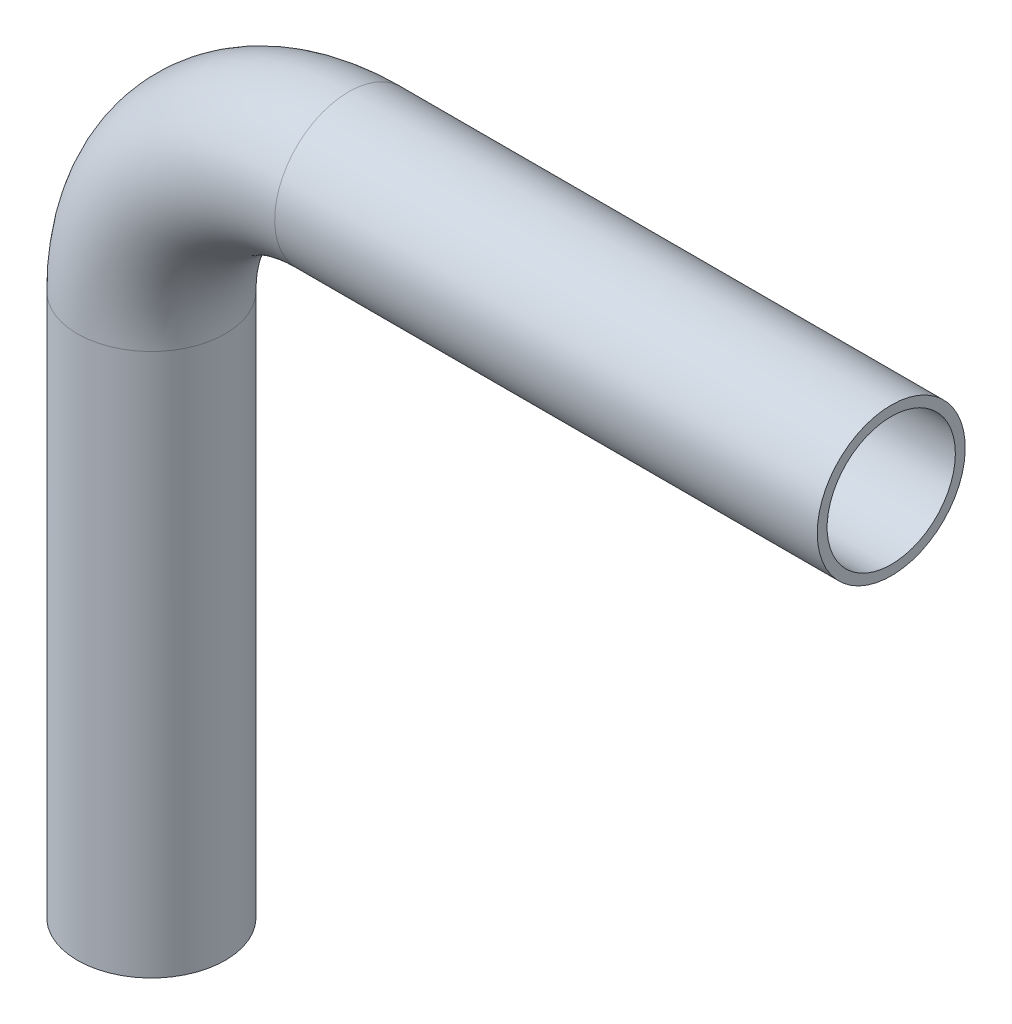
from build123d import *

# Parameters (mm, degrees)
ESBO_O2_R = 15
CASCA1_T  = -2


with BuildPart() as part:
    # Varredura1: sweep along a path in Esboço1
    with BuildLine(Plane.XY) as varredura1_path:
        Line((0, 0), (0, 110))
        ThreePointArc((0, 110), (11.715728753, 138.284271247), (40, 150))
        Line((40, 150), (150, 150))
    # Esboço2 → Varredura1 (sweep)
    with BuildSketch(Plane(origin=(0, 0, 0), x_dir=(1, 0, 0), z_dir=(0, 1, 0))):
        Circle(ESBO_O2_R)
    sweep(path=varredura1_path.line)

    # Casca1
    casca1_openings = [part.faces().sort_by_distance(p)[0] for p in [
        (150, 150, 0),
        (0, 0, 0),
    ]]
    offset(amount=CASCA1_T, openings=casca1_openings, kind=Kind.INTERSECTION)


solid = part.part
